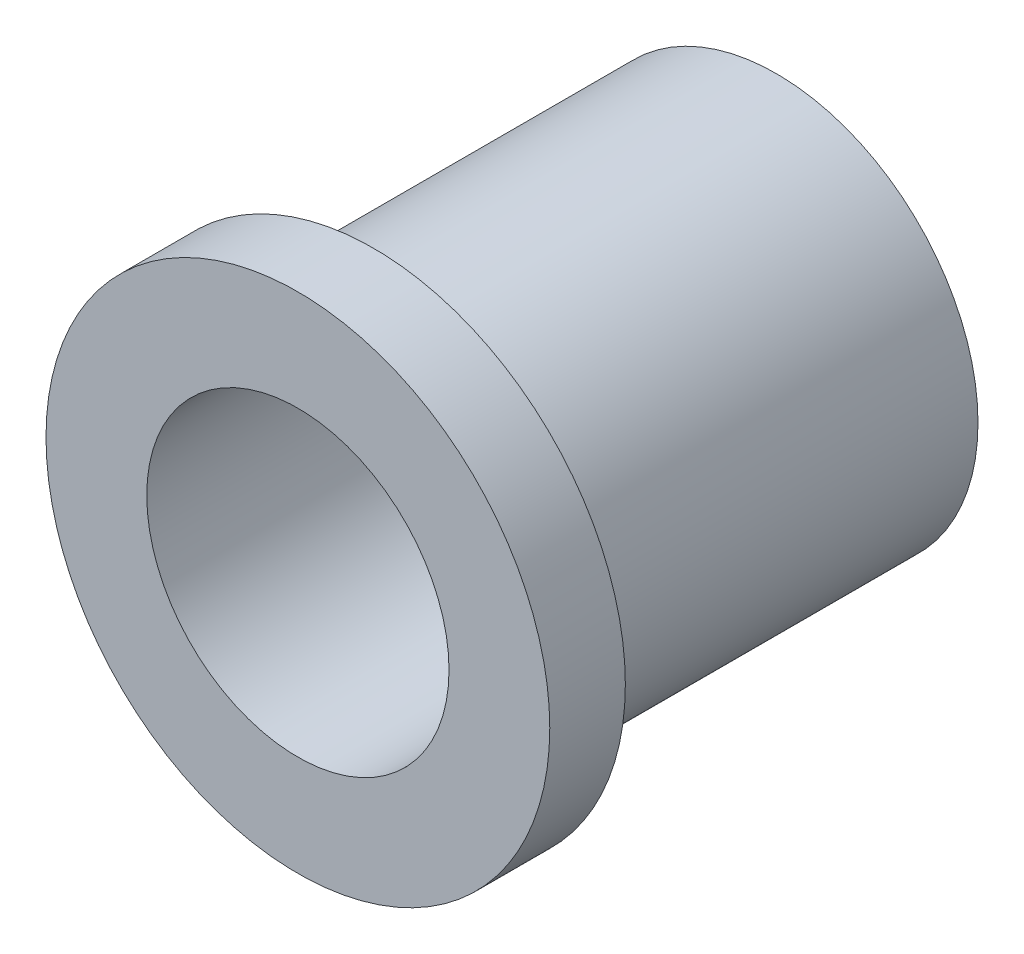
from build123d import *

# Parameters (mm, degrees)
SKETCH1_R           = 12.7
SKETCH1_R_2         = 9.525
BOSS_EXTRUDE1_DEPTH = 12.7
SKETCH2_R           = 15.875
SKETCH2_R_2         = 9.525
BOSS_EXTRUDE2_DEPTH = 4.7625


with BuildPart() as part:
    # Sketch1 → Boss-Extrude1 (new, symmetric)
    with BuildSketch(Plane.XY):
        Circle(SKETCH1_R)
        Circle(SKETCH1_R_2, mode=Mode.SUBTRACT)
    extrude(amount=BOSS_EXTRUDE1_DEPTH, both=True)

    # Sketch2 → Boss-Extrude2 (add)
    with BuildSketch(Plane.XY.offset(12.7)):
        with Locations(Location((0, 0, 0), (0, 0, 180))):
            Circle(SKETCH2_R)
        Circle(SKETCH2_R_2, mode=Mode.SUBTRACT)
    extrude(amount=BOSS_EXTRUDE2_DEPTH)


solid = part.part
